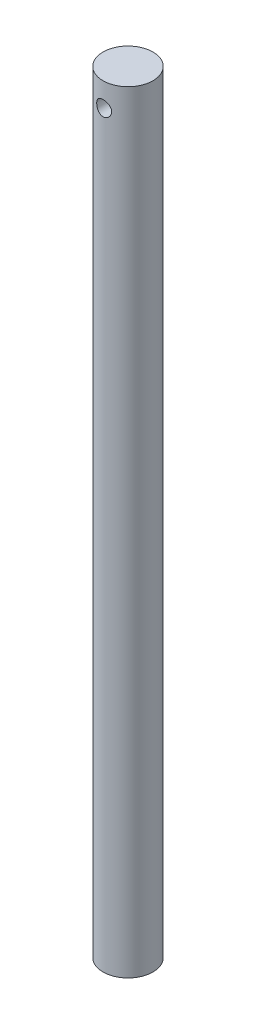
from build123d import *

# Parameters (mm, degrees)
SKETCH_2_R               = 10
EXTRUDE_1_DEPTH          = 309.5
CUT_EXTRUDE_2_DEPTH      = 310.822933302
CUT_EXTRUDE_2_DEPTH_BACK = 310.822933302
SKETCH_3_R               = 3


with BuildPart() as part:
    # 草图2 → 凸台-拉伸1 (new body)
    with BuildSketch(Plane(origin=(0, 0, 0), x_dir=(1, 0, 0), z_dir=(0, 1, 0))):
        with Locations(Location((0, 0, 0), (0, 0, 270))):
            Circle(SKETCH_2_R)
    extrude(amount=EXTRUDE_1_DEPTH)

    # 草图3 → 切除-拉伸2 (cut, two sides: drawn at the far end of the back side and taken through both)
    with BuildSketch(Plane.XY.offset(-CUT_EXTRUDE_2_DEPTH_BACK)):
        with Locations(Location((0, 300, 0), (0, 0, 89.999999982))):
            Circle(SKETCH_3_R)
    extrude(amount=CUT_EXTRUDE_2_DEPTH + CUT_EXTRUDE_2_DEPTH_BACK, mode=Mode.SUBTRACT)


solid = part.part
